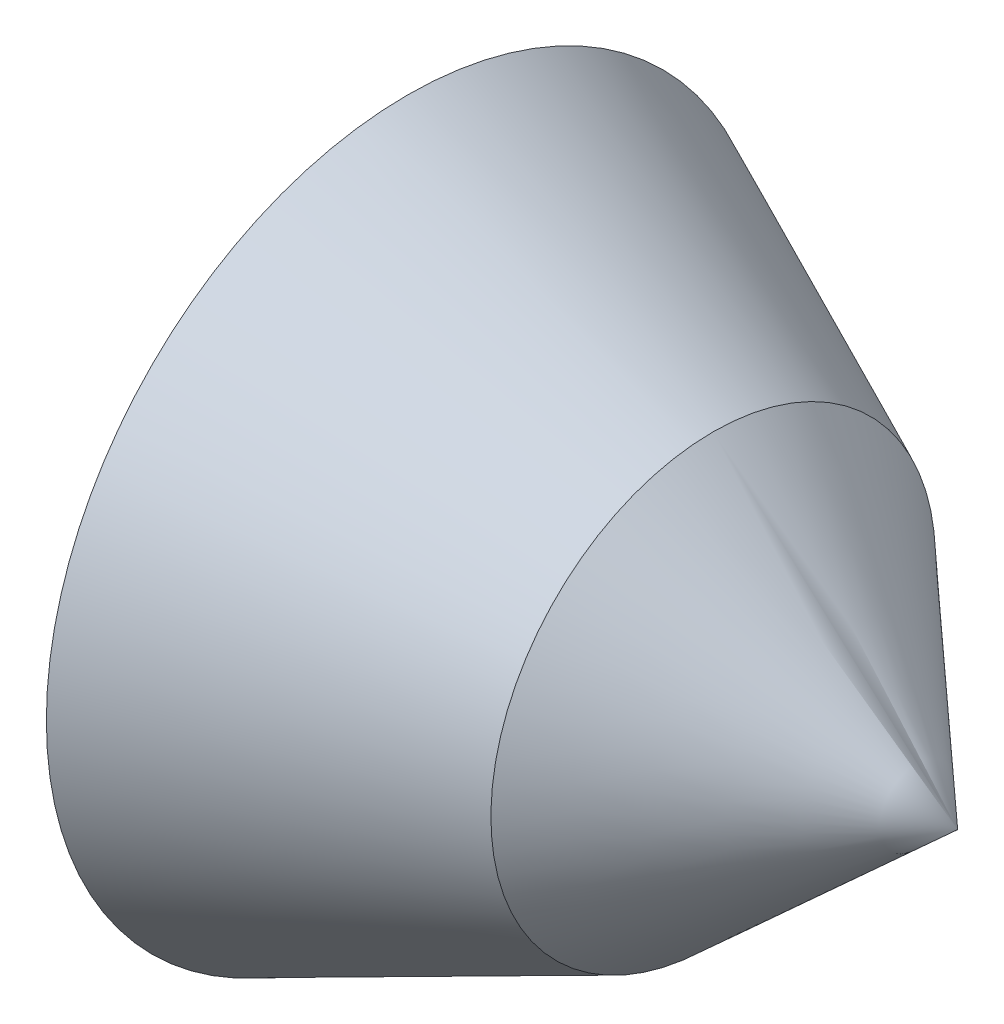
from build123d import *

# Parameters (mm, degrees)
REVOLVE1_ANGLE = 359.999999589


with BuildPart() as part:
    # Sketch1 → Revolve1 (revolve)
    with BuildSketch(Plane.XY):
        Polygon((6300, 350), (6300, 650), (6850, 400), (7290, 0), (6300, 0), align=None)
    revolve(axis=Axis((0, 0, 0), (1, 0, 0)), revolution_arc=REVOLVE1_ANGLE)


solid = part.part
